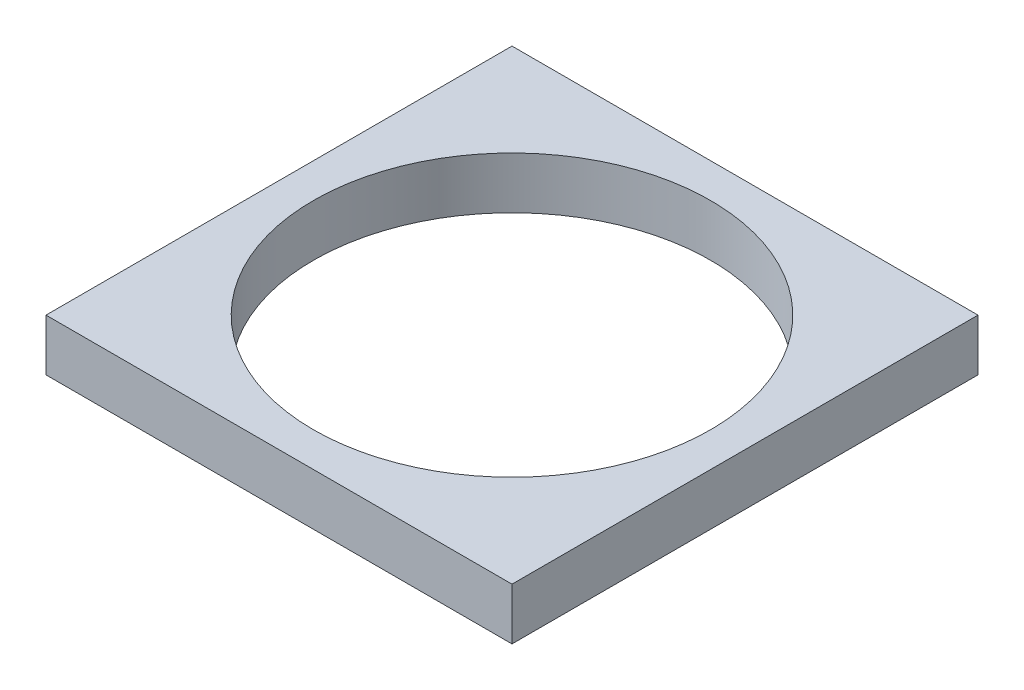
from build123d import *

# Parameters (mm, degrees)
SKETCH1_W           = 45
SKETCH1_H           = 45
BOSS_EXTRUDE1_DEPTH = 5
SKETCH2_R           = 19.175
CUT_EXTRUDE1_DEPTH  = 5


with BuildPart() as part:
    # Sketch1 → Boss-Extrude1 (new body)
    with BuildSketch(Plane(origin=(0, 0, 0), x_dir=(1, 0, 0), z_dir=(0, 1, 0))):
        Rectangle(SKETCH1_W, SKETCH1_H)
    extrude(amount=BOSS_EXTRUDE1_DEPTH)

    # Sketch2 → Cut-Extrude1 (cut)
    with BuildSketch(Plane(origin=(0, 5, 0), x_dir=(1, 0, 0), z_dir=(0, 1, 0))):
        with Locations(Location((0, 0, 0), (0, 0, 270))):
            Circle(SKETCH2_R)
    extrude(amount=-CUT_EXTRUDE1_DEPTH, mode=Mode.SUBTRACT)


solid = part.part
